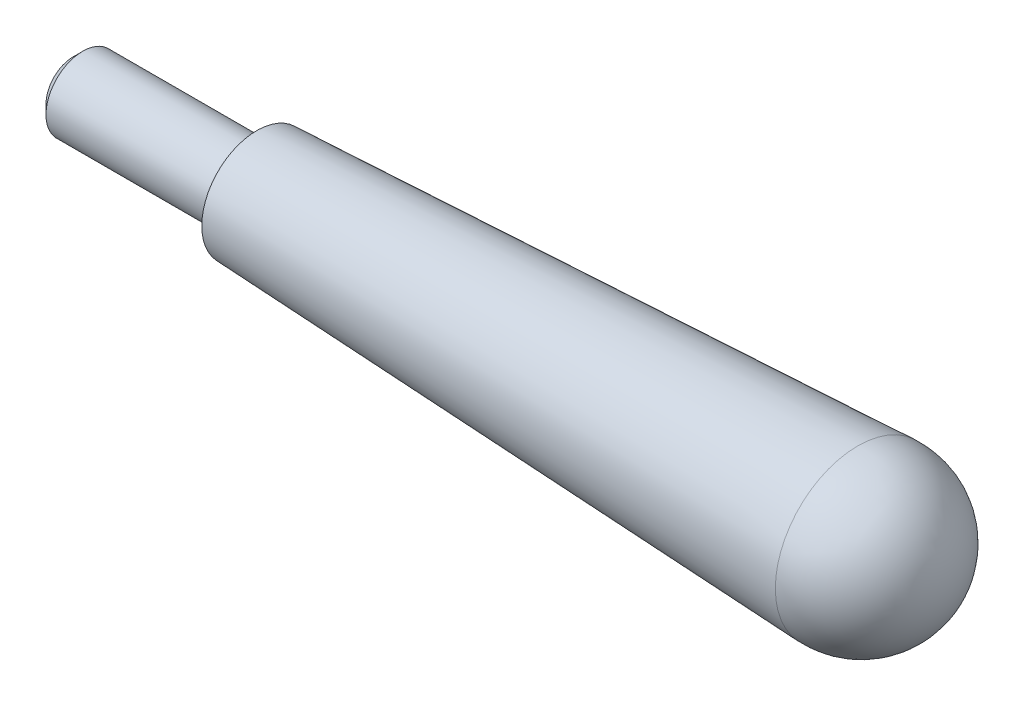
from build123d import *

# Parameters (mm, degrees)
CHAMFER_1_SIZE = 1


with BuildPart() as part:
    # Эскиз1 → Повернуть1 (revolve)
    with BuildSketch(Plane.XY, mode=Mode.PRIVATE) as revolve_1_sk:
        with BuildLine():
            Line((0, 0), (0, 4))
            Line((0, 4), (20, 4))
            Line((20, 4), (20, 6))
            Line((20, 6), (85.590059908, 8.990658993))
            ThreePointArc((85.590059908, 8.990658993), (92.217336213, 6.507282875), (95, 0))
            Line((95, 0), (86, 0))
            Line((86, 0), (0, 0))
        make_face()
    revolve(revolve_1_sk.sketch.rotate(Axis((0, 0, 0), (1, 0, 0)), 90), axis=Axis((0, 0, 0), (1, 0, 0)))

    # Фаска1
    chamfer_1_edges = [part.edges().sort_by_distance(p)[0] for p in [
        (0, 0, -4),
    ]]
    chamfer(chamfer_1_edges, length=CHAMFER_1_SIZE)


solid = part.part
